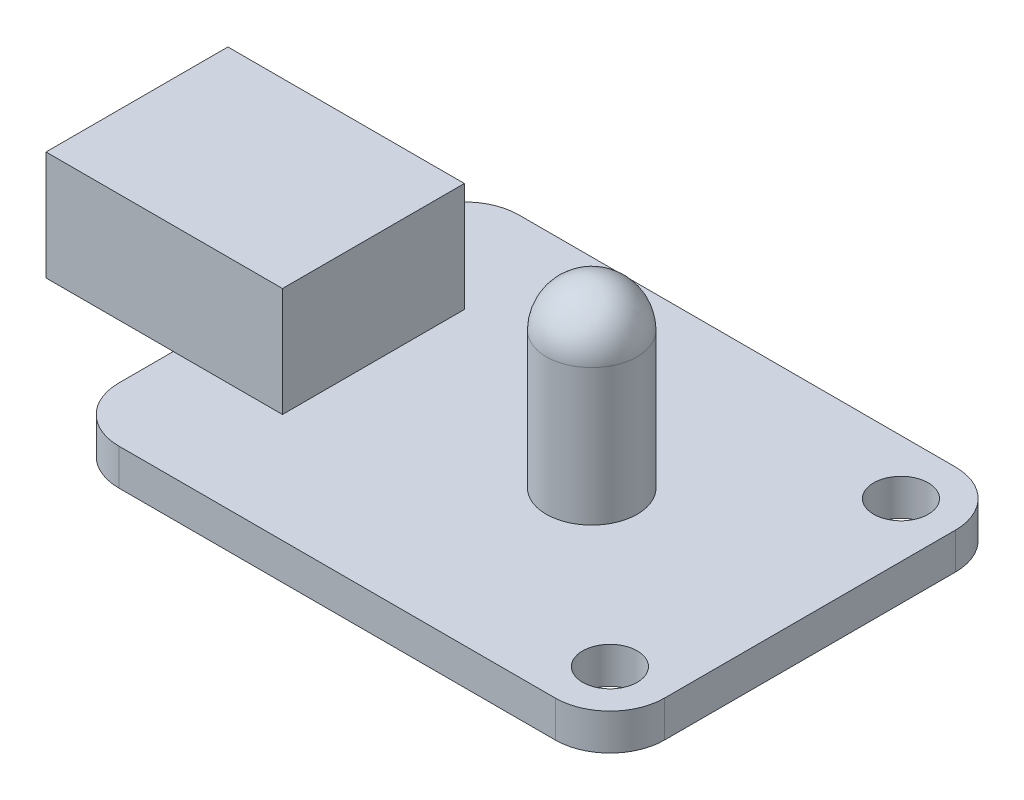
from build123d import *

# Parameters (mm, degrees)
SKETCH1_R           = 1.5
BOSS_EXTRUDE1_DEPTH = 2
SKETCH2_W           = 13
SKETCH2_H           = 10
BOSS_EXTRUDE2_DEPTH = 6
SKETCH3_R           = 2.5
BOSS_EXTRUDE3_DEPTH = 10
FILLET1_R           = 2.5


with BuildPart() as part:
    # Sketch1 → Boss-Extrude1 (new body)
    with BuildSketch(Plane(origin=(0, 0, 0), x_dir=(1, 0, 0), z_dir=(0, 1, 0))):
        with BuildLine():
            Line((-12, 11), (12, 11))
            ThreePointArc((12, 11), (14.121320344, 10.121320344), (15, 8))
            Line((15, 8), (15, -8))
            ThreePointArc((15, -8), (14.121320344, -10.121320344), (12, -11))
            Line((12, -11), (-12, -11))
            ThreePointArc((-12, -11), (-14.121320344, -10.121320344), (-15, -8))
            Line((-15, -8), (-15, 8))
            ThreePointArc((-15, 8), (-14.121320344, 10.121320344), (-12, 11))
        make_face()
        with Locations(Location((12, 8, 0), (0, 0, 270))):
            Circle(SKETCH1_R, mode=Mode.SUBTRACT)
        with Locations(Location((12, -8, 0), (0, 0, 270))):
            Circle(SKETCH1_R, mode=Mode.SUBTRACT)
    extrude(amount=BOSS_EXTRUDE1_DEPTH)

    # Sketch2 → Boss-Extrude2 (add)
    with BuildSketch(Plane(origin=(0, 2, 0), x_dir=(1, 0, 0), z_dir=(0, 1, 0))):
        with Locations((-15.5, 0)):
            Rectangle(SKETCH2_W, SKETCH2_H)
    extrude(amount=BOSS_EXTRUDE2_DEPTH)

    # Sketch3 → Boss-Extrude3 (add)
    with BuildSketch(Plane(origin=(0, 2, 0), x_dir=(1, 0, 0), z_dir=(0, 1, 0))):
        with Locations(Location((3, 0, 0), (0, 0, 270))):
            Circle(SKETCH3_R)
    extrude(amount=BOSS_EXTRUDE3_DEPTH)

    # Fillet1
    fillet1_edges = [part.edges().sort_by_distance(p)[0] for p in [
        (3, 12, -2.5),
    ]]
    fillet(fillet1_edges, radius=FILLET1_R)


solid = part.part
